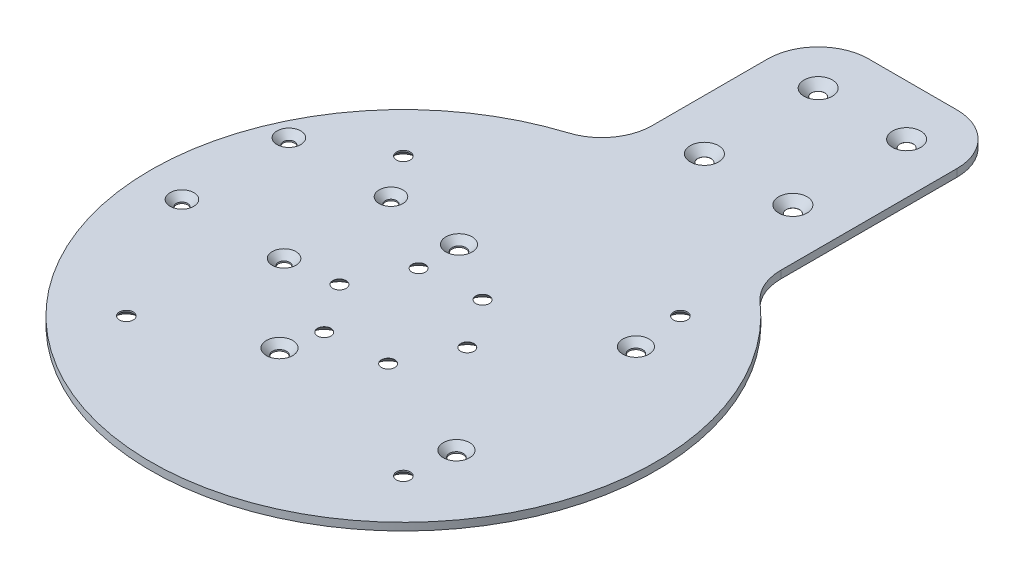
from build123d import *

# Parameters (mm, degrees)
SKETCH1_R                                      = 100
BOSS_EXTRUDE1_DEPTH                            = 3
CSK_FOR_M5_SFHCS1_AT_2_COUNT                   = 2
CSK_FOR_M5_SFHCS1_AT_2_PITCH                   = 23.5
CSK_FOR_M5_SFHCS1_AT_3_COUNT                   = 2
CSK_FOR_M5_SFHCS1_AT_3_PITCH                   = 40.703193978
CSK_FOR_M5_SFHCS1_AT_4_COUNT                   = 2
CSK_FOR_M5_SFHCS1_AT_4_PITCH                   = 47
CSK_FOR_M5_SFHCS1_AT_5_COUNT                   = 2
CSK_FOR_M5_SFHCS1_AT_5_PITCH                   = 40.703193978
CSK_FOR_M5_SFHCS1_AT_6_COUNT                   = 2
CSK_FOR_M5_SFHCS1_AT_6_PITCH                   = 23.5
BOSS_EXTRUDE2_DEPTH                            = 3
FILLET1_R                                      = 20
CSK_FOR_M5_SFHCS2_AT_2_COUNT                   = 2
CSK_FOR_M5_SFHCS2_AT_2_PITCH                   = 35
CSK_FOR_M5_SFHCS2_AT_3_COUNT                   = 2
CSK_FOR_M5_SFHCS2_AT_3_PITCH                   = 45
CSK_FOR_M5_SFHCS2_AT_4_COUNT                   = 2
CSK_FOR_M5_SFHCS2_AT_4_PITCH                   = 57.008771255
CSK_FOR_M5_FLAT_HEAD_MACHINE_SCREW2_AT_2_COUNT = 2
CSK_FOR_M5_FLAT_HEAD_MACHINE_SCREW2_AT_2_PITCH = 70
CSK_FOR_M5_FLAT_HEAD_MACHINE_SCREW2_AT_3_COUNT = 2
CSK_FOR_M5_FLAT_HEAD_MACHINE_SCREW2_AT_3_PITCH = 99.704563587
CSK_FOR_M5_FLAT_HEAD_MACHINE_SCREW2_AT_4_COUNT = 2
CSK_FOR_M5_FLAT_HEAD_MACHINE_SCREW2_AT_4_PITCH = 71
CSK_FOR_M4_FLAT_HEAD_MACHINE_SCREW1_AT_2_COUNT = 2
CSK_FOR_M4_FLAT_HEAD_MACHINE_SCREW1_AT_2_PITCH = 42.3
CSK_FOR_M4_FLAT_HEAD_MACHINE_SCREW1_AT_3_COUNT = 2
CSK_FOR_M4_FLAT_HEAD_MACHINE_SCREW1_AT_3_PITCH = 40.4
CSK_FOR_M4_FLAT_HEAD_MACHINE_SCREW1_AT_4_COUNT = 2
CSK_FOR_M4_FLAT_HEAD_MACHINE_SCREW1_AT_4_PITCH = 58.493161994
CSK_FOR_M5_FLAT_HEAD_MACHINE_SCREW3_AT_2_COUNT = 2
CSK_FOR_M5_FLAT_HEAD_MACHINE_SCREW3_AT_2_PITCH = 155
CSK_FOR_M5_FLAT_HEAD_MACHINE_SCREW3_AT_3_COUNT = 2
CSK_FOR_M5_FLAT_HEAD_MACHINE_SCREW3_AT_3_PITCH = 109.601551084
CSK_FOR_M5_FLAT_HEAD_MACHINE_SCREW3_AT_4_COUNT = 2
CSK_FOR_M5_FLAT_HEAD_MACHINE_SCREW3_AT_4_PITCH = 109.601551084


with BuildPart() as part:
    # Sketch1 → Boss-Extrude1 (new body)
    with BuildSketch(Plane(origin=(0, 0, 0), x_dir=(1, 0, 0), z_dir=(0, 1, 0))):
        with Locations(Location((0, 0, 0), (0, 0, 270))):
            Circle(SKETCH1_R)
    extrude(amount=BOSS_EXTRUDE1_DEPTH)

    # Sketch6 → CSK for M5 SFHCS1 (revolve, cut)
    with BuildSketch(Plane(origin=(-13.325081846, 0, -19.356967578), x_dir=(0, 0, -1), z_dir=(1, 0, 0))):
        Polygon((0, 0), (0, 3), (2.65, 3), (2.65, 2.95), (5.6, 0), align=None)
    csk_for_m5_sfhcs1 = revolve(axis=Axis((-13.325081846, -6.35, -19.356967578), (0, 1, 0)), mode=Mode.SUBTRACT)

    # CSK for M5 SFHCS1 at 2: CSK for M5 SFHCS1 ×2
    with Locations(*[Vector(0.9968581525690036, 0, -0.07920747222777241) * (i * CSK_FOR_M5_SFHCS1_AT_2_PITCH) for i in range(1, CSK_FOR_M5_SFHCS1_AT_2_COUNT)]):
        add(csk_for_m5_sfhcs1, mode=Mode.SUBTRACT)

    # CSK for M5 SFHCS1 at 3: CSK for M5 SFHCS1 ×2
    with Locations(*[Vector(0.902908220208267, 0, 0.4298333931657005) * (i * CSK_FOR_M5_SFHCS1_AT_3_PITCH) for i in range(1, CSK_FOR_M5_SFHCS1_AT_3_COUNT)]):
        add(csk_for_m5_sfhcs1, mode=Mode.SUBTRACT)

    # CSK for M5 SFHCS1 at 4: CSK for M5 SFHCS1 ×2
    with Locations(*[Vector(0.5670247594033001, 0, 0.8237007479804968) * (i * CSK_FOR_M5_SFHCS1_AT_4_PITCH) for i in range(1, CSK_FOR_M5_SFHCS1_AT_4_COUNT)]):
        add(csk_for_m5_sfhcs1, mode=Mode.SUBTRACT)

    # CSK for M5 SFHCS1 at 5: CSK for M5 SFHCS1 ×2
    with Locations(*[Vector(0.07920747222776865, 0, 0.9968581525690039) * (i * CSK_FOR_M5_SFHCS1_AT_5_PITCH) for i in range(1, CSK_FOR_M5_SFHCS1_AT_5_COUNT)]):
        add(csk_for_m5_sfhcs1, mode=Mode.SUBTRACT)

    # CSK for M5 SFHCS1 at 6: CSK for M5 SFHCS1 ×2
    with Locations(*[Vector(-0.4298333931657009, 0, 0.9029082202082669) * (i * CSK_FOR_M5_SFHCS1_AT_6_PITCH) for i in range(1, CSK_FOR_M5_SFHCS1_AT_6_COUNT)]):
        add(csk_for_m5_sfhcs1, mode=Mode.SUBTRACT)

    # Sketch7 → Boss-Extrude2 (add)
    with BuildSketch(Plane.XZ):
        with BuildLine():
            Line((-16, -98.711701434), (-16, -180.1))
            Line((-16, -180.1), (59, -180.1))
            Line((59, -180.1), (59, -80.740324498))
            ThreePointArc((59, -80.740324498), (23.302201554, -97.247145988), (-16, -98.711701434))
        make_face()
    extrude(amount=-BOSS_EXTRUDE2_DEPTH)

    # Fillet1
    fillet1_edges = [part.edges().sort_by_distance(p)[0] for p in [
        (-16, 1.5, -98.711701434),
        (59, 1.5, -80.740324498),
        (59, 1.5, -180.1),
        (-16, 1.5, -180.1),
    ]]
    fillet(fillet1_edges, radius=FILLET1_R)

    # Sketch14 → CSK for M5 SFHCS2 (revolve, cut)
    with BuildSketch(Plane(origin=(39, 3, -160.1), x_dir=(0, 0, 1), z_dir=(1, 0, 0))):
        Polygon((0, 0), (0, 3), (2.65, 3), (2.65, 2.95), (5.6, 0), align=None)
    csk_for_m5_sfhcs2 = revolve(axis=Axis((39, 9.35, -160.1), (0, -1, 0)), mode=Mode.SUBTRACT)

    # CSK for M5 SFHCS2 at 2: CSK for M5 SFHCS2 ×2
    with Locations(*[(-i * CSK_FOR_M5_SFHCS2_AT_2_PITCH, 0, 0) for i in range(1, CSK_FOR_M5_SFHCS2_AT_2_COUNT)]):
        add(csk_for_m5_sfhcs2, mode=Mode.SUBTRACT)

    # CSK for M5 SFHCS2 at 3: CSK for M5 SFHCS2 ×2
    with Locations(*[(0, 0, i * CSK_FOR_M5_SFHCS2_AT_3_PITCH) for i in range(1, CSK_FOR_M5_SFHCS2_AT_3_COUNT)]):
        add(csk_for_m5_sfhcs2, mode=Mode.SUBTRACT)

    # CSK for M5 SFHCS2 at 4: CSK for M5 SFHCS2 ×2
    with Locations(*[Vector(-0.6139406135149205, 0, 0.7893522173763264) * (i * CSK_FOR_M5_SFHCS2_AT_4_PITCH) for i in range(1, CSK_FOR_M5_SFHCS2_AT_4_COUNT)]):
        add(csk_for_m5_sfhcs2, mode=Mode.SUBTRACT)

    # Sketch17 → CSK for M5 Flat Head Machine Screw2 (revolve, cut)
    with BuildSketch(Plane(origin=(56.5, 3, -35.5), x_dir=(0, 0, 1), z_dir=(1, 0, 0))):
        Polygon((0, 0), (0, 3), (2.75, 3), (2.75, 2.45), (5.2, 0), align=None)
    csk_for_m5_flat_head_machine_screw2 = revolve(axis=Axis((56.5, 9.35, -35.5), (0, -1, 0)), mode=Mode.SUBTRACT)

    # CSK for M5 Flat Head Machine Screw2 at 2: CSK for M5 Flat Head Machine Screw2 ×2
    with Locations(*[(-i * CSK_FOR_M5_FLAT_HEAD_MACHINE_SCREW2_AT_2_PITCH, 0, 0) for i in range(1, CSK_FOR_M5_FLAT_HEAD_MACHINE_SCREW2_AT_2_COUNT)]):
        add(csk_for_m5_flat_head_machine_screw2, mode=Mode.SUBTRACT)

    # CSK for M5 Flat Head Machine Screw2 at 3: CSK for M5 Flat Head Machine Screw2 ×2
    with Locations(*[Vector(-0.7020741827848285, 0, 0.7121038139674688) * (i * CSK_FOR_M5_FLAT_HEAD_MACHINE_SCREW2_AT_3_PITCH) for i in range(1, CSK_FOR_M5_FLAT_HEAD_MACHINE_SCREW2_AT_3_COUNT)]):
        add(csk_for_m5_flat_head_machine_screw2, mode=Mode.SUBTRACT)

    # CSK for M5 Flat Head Machine Screw2 at 4: CSK for M5 Flat Head Machine Screw2 ×2
    with Locations(*[(0, 0, i * CSK_FOR_M5_FLAT_HEAD_MACHINE_SCREW2_AT_4_PITCH) for i in range(1, CSK_FOR_M5_FLAT_HEAD_MACHINE_SCREW2_AT_4_COUNT)]):
        add(csk_for_m5_flat_head_machine_screw2, mode=Mode.SUBTRACT)

    # Sketch19 → CSK for M4 Flat Head Machine Screw1 (revolve, cut)
    with BuildSketch(Plane(origin=(-43.3, 3, -38.4), x_dir=(0, 0, 1), z_dir=(1, 0, 0))):
        Polygon((0, 0), (0, 3), (2.25, 3), (2.25, 2.45), (4.7, 0), align=None)
    csk_for_m4_flat_head_machine_screw1 = revolve(axis=Axis((-43.3, 9.35, -38.4), (0, -1, 0)), mode=Mode.SUBTRACT)

    # CSK for M4 Flat Head Machine Screw1 at 2: CSK for M4 Flat Head Machine Screw1 ×2
    with Locations(*[(0, 0, i * CSK_FOR_M4_FLAT_HEAD_MACHINE_SCREW1_AT_2_PITCH) for i in range(1, CSK_FOR_M4_FLAT_HEAD_MACHINE_SCREW1_AT_2_COUNT)]):
        add(csk_for_m4_flat_head_machine_screw1, mode=Mode.SUBTRACT)

    # CSK for M4 Flat Head Machine Screw1 at 3: CSK for M4 Flat Head Machine Screw1 ×2
    with Locations(*[(-i * CSK_FOR_M4_FLAT_HEAD_MACHINE_SCREW1_AT_3_PITCH, 0, 0) for i in range(1, CSK_FOR_M4_FLAT_HEAD_MACHINE_SCREW1_AT_3_COUNT)]):
        add(csk_for_m4_flat_head_machine_screw1, mode=Mode.SUBTRACT)

    # CSK for M4 Flat Head Machine Screw1 at 4: CSK for M4 Flat Head Machine Screw1 ×2
    with Locations(*[Vector(-0.6906790233784355, 0, 0.7231614526957384) * (i * CSK_FOR_M4_FLAT_HEAD_MACHINE_SCREW1_AT_4_PITCH) for i in range(1, CSK_FOR_M4_FLAT_HEAD_MACHINE_SCREW1_AT_4_COUNT)]):
        add(csk_for_m4_flat_head_machine_screw1, mode=Mode.SUBTRACT)

    # Sketch21 → CSK for M5 Flat Head Machine Screw3 (revolve, cut)
    with BuildSketch(Plane(origin=(-54.800775542, 0, 54.800775542), x_dir=(0, 0, -1), z_dir=(1, 0, 0))):
        Polygon((0, 0), (0, 3), (2.75, 3), (2.75, 2.45), (5.2, 0), align=None)
    csk_for_m5_flat_head_machine_screw3 = revolve(axis=Axis((-54.800775542, -6.35, 54.800775542), (0, 1, 0)), mode=Mode.SUBTRACT)

    # CSK for M5 Flat Head Machine Screw3 at 2: CSK for M5 Flat Head Machine Screw3 ×2
    with Locations(*[Vector(0.7071067811865415, 0, -0.7071067811865537) * (i * CSK_FOR_M5_FLAT_HEAD_MACHINE_SCREW3_AT_2_PITCH) for i in range(1, CSK_FOR_M5_FLAT_HEAD_MACHINE_SCREW3_AT_2_COUNT)]):
        add(csk_for_m5_flat_head_machine_screw3, mode=Mode.SUBTRACT)

    # CSK for M5 Flat Head Machine Screw3 at 3: CSK for M5 Flat Head Machine Screw3 ×2
    with Locations(*[(0, 0, -i * CSK_FOR_M5_FLAT_HEAD_MACHINE_SCREW3_AT_3_PITCH) for i in range(1, CSK_FOR_M5_FLAT_HEAD_MACHINE_SCREW3_AT_3_COUNT)]):
        add(csk_for_m5_flat_head_machine_screw3, mode=Mode.SUBTRACT)

    # CSK for M5 Flat Head Machine Screw3 at 4: CSK for M5 Flat Head Machine Screw3 ×2
    with Locations(*[(i * CSK_FOR_M5_FLAT_HEAD_MACHINE_SCREW3_AT_4_PITCH, 0, 0) for i in range(1, CSK_FOR_M5_FLAT_HEAD_MACHINE_SCREW3_AT_4_COUNT)]):
        add(csk_for_m5_flat_head_machine_screw3, mode=Mode.SUBTRACT)


solid = part.part
